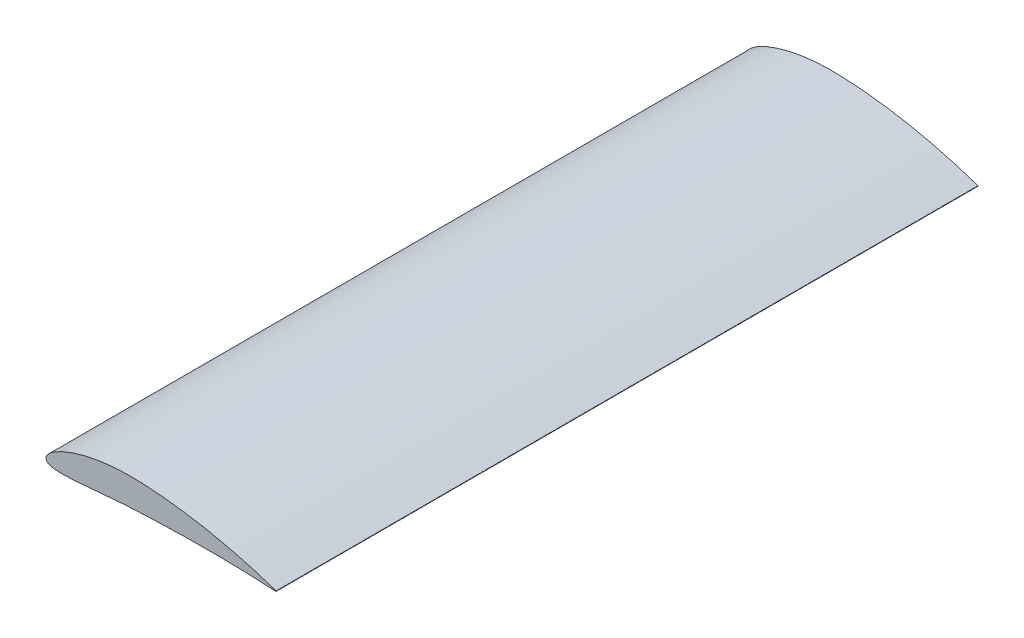
from build123d import *

# Parameters (mm, degrees)
BOSS_EXTRUDE1_DEPTH = 610


with BuildPart() as part:
    # Sketch1 → Boss-Extrude1 (new, symmetric)
    with BuildSketch(Plane.XY):
        with BuildLine():
            Line((399.901631597, -56.627345623), (400, -56.131460424))
            add(Edge.make_bspline(
                [(400, -56.131460424), (399.643918554, -56.010024389), (398.225182447, -55.526186521), (395.049408189, -54.441261085), (389.783373866, -52.691290288), (382.482718123, -50.309246782), (373.209959493, -47.393587022), (362.051946032, -44.035857906), (349.11844487, -40.342042518), (334.534016292, -36.429273985), (318.445847385, -32.4164876), (301.0158708, -28.431641847), (282.430745598, -24.575544274), (262.884756986, -20.974334448), (242.588909845, -17.735074929), (221.766202389, -14.94282936), (200.65078527, -12.688610449), (179.469337759, -11.045344798), (158.317419739, -9.988790582), (137.422408652, -9.921840783), (117.076822685, -11.006206352), (97.702575667, -13.138546201), (79.555667165, -16.195767633), (62.874623266, -20.046177105), (47.868097651, -24.503676936), (34.711044711, -29.37001919), (23.544592011, -34.449534353), (14.474024333, -39.547505009), (7.539118331, -44.48465454), (2.776793903, -49.154004419), (0.040878501, -53.570636527), (-0.194546817, -58.00796822), (2.446449083, -61.554127886), (7.063816716, -63.765449129), (13.407098507, -65.206932663), (21.575953369, -65.947371208), (31.489258532, -66.069787665), (43.052323872, -65.638905727), (56.135301593, -64.752489091), (70.604122147, -63.510988991), (86.318479683, -62.051604877), (103.137102564, -60.495358435), (120.914651969, -58.973090556), (139.503910062, -57.621608066), (158.899188374, -56.586397016), (178.927680162, -55.835447525), (199.378638327, -55.061880353), (219.896731539, -54.430887033), (240.253059314, -53.956810924), (260.23057542, -53.66422182), (279.609294351, -53.562697469), (298.173165924, -53.640911787), (315.712834065, -53.868571706), (332.025978311, -54.237699809), (346.921244917, -54.675675756), (360.228403072, -55.17515821), (371.761412466, -55.65444425), (381.458692991, -56.170812242), (388.980801901, -56.411999414), (394.775205354, -57.066334595), (397.644422256, -56.640155398), (399.856156274, -57.446030239), (399.890869461, -56.82109456), (399.901631597, -56.627345623)],
                knots=[0, 0, 0, 0, 0.001371577, 0.005464776, 0.012234802, 0.021601969, 0.033461345, 0.04767125, 0.064081318, 0.082496261, 0.102719149, 0.124527079, 0.147675648, 0.171912573, 0.19697838, 0.222596912, 0.248496767, 0.274385101, 0.300041178, 0.325689988, 0.350525088, 0.374279703, 0.396711254, 0.417576734, 0.436654006, 0.45374439, 0.468679994, 0.481329415, 0.491630702, 0.499615789, 0.505546281, 0.510184984, 0.514824194, 0.520701508, 0.52851604, 0.538465752, 0.550542609, 0.564643256, 0.580638139, 0.598344876, 0.617584458, 0.638174401, 0.65992209, 0.682632113, 0.706120665, 0.730727383, 0.755700244, 0.780731769, 0.805564463, 0.829932396, 0.853570292, 0.876213105, 0.897609987, 0.917519394, 0.935698347, 0.951942678, 0.966047159, 0.97783994, 0.987174002, 0.993931501, 0.998018399, 0.999385644, 1, 1, 1, 1], degree=3))
        make_face()
    extrude(amount=BOSS_EXTRUDE1_DEPTH, both=True)


solid = part.part
